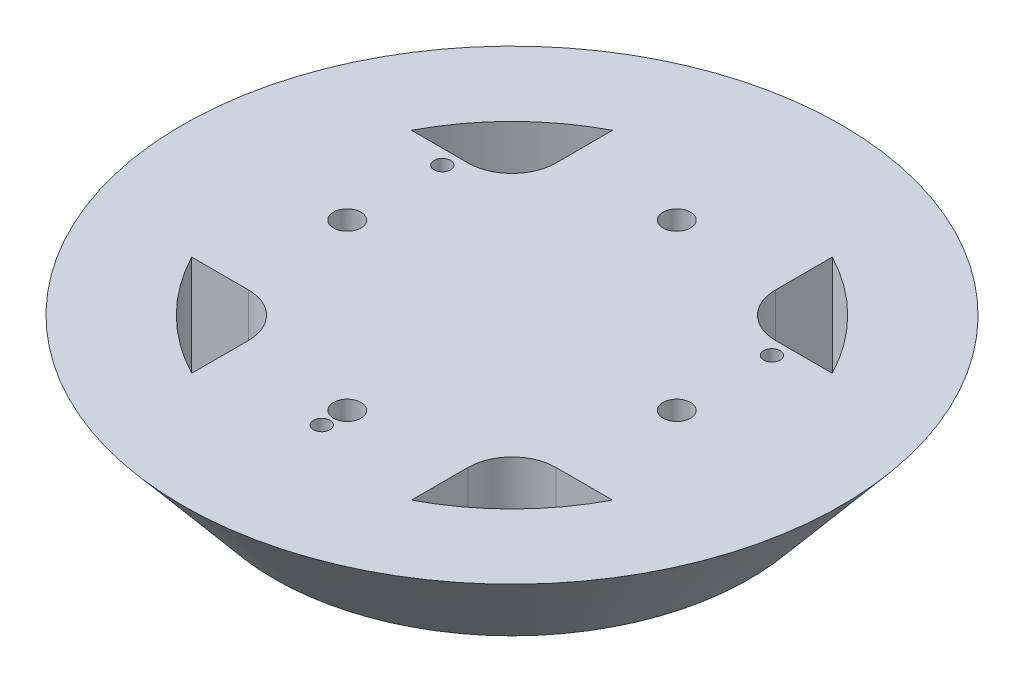
from build123d import *

# Parameters (mm, degrees)
SKETCH1_R             = 60
BOSS_EXTRUDE1_DEPTH   = 20
BOSS_EXTRUDE1_DRAFT   = -40
CUT_EXTRUDE1_DEPTH    = 25
F_3_0MM_DOWEL_HOLE1_D = 3
FILLET1_R             = 8
SKETCH13_R            = 2.5
CUT_EXTRUDE5_DEPTH    = 10


with BuildPart() as part:
    # Sketch1 → Boss-Extrude1 (with draft: the straight prism first)
    with BuildSketch(Plane(origin=(0, 0, 0), x_dir=(1, 0, 0), z_dir=(0, 1, 0))):
        Circle(SKETCH1_R)
    extrude(amount=-BOSS_EXTRUDE1_DEPTH)
    # Boss-Extrude1: the draft: its side faces are tilted about the plane it starts from
    boss_extrude1_sides = [part.faces().sort_by_distance(p)[0] for p in [
        (-60, -10, 0),
    ]]
    draft(boss_extrude1_sides, Plane(origin=(0, 0, 0), x_dir=(1, 0, 0), z_dir=(0, 1, 0)), BOSS_EXTRUDE1_DRAFT)

    # Sketch5 → Cut-Extrude1 (cut)
    with BuildSketch(Plane.XZ.offset(20)):
        with BuildLine():
            Line((-20, 20), (-20, 38.311827959))
            ThreePointArc((-20, 38.311827959), (-30.559746085, 30.559746085), (-38.311827959, 20))
            Line((-38.311827959, 20), (-20, 20))
        make_face()
        with BuildLine():
            ThreePointArc((38.311827959, 20), (30.559746085, 30.559746085), (20, 38.311827959))
            Line((20, 38.311827959), (20, 20))
            Line((20, 20), (38.311827959, 20))
        make_face()
        with BuildLine():
            Line((-20, -20), (-38.311827959, -20))
            ThreePointArc((-38.311827959, -20), (-30.559746085, -30.559746085), (-20, -38.311827959))
            Line((-20, -38.311827959), (-20, -20))
        make_face()
        with BuildLine():
            ThreePointArc((20, -38.311827959), (30.559746085, -30.559746085), (38.311827959, -20))
            Line((38.311827959, -20), (20, -20))
            Line((20, -20), (20, -38.311827959))
        make_face()
    extrude(amount=-CUT_EXTRUDE1_DEPTH, mode=Mode.SUBTRACT)

    # Ø3.0mm Dowel Hole1 (through all)
    with Locations(Plane(origin=(0, -20, 0), x_dir=(-1, 0, 0), z_dir=(0, -1, 0))):
        with Locations((0, -34.64), (-29.999119987, 17.32), (29.999119987, 17.32)):
            Hole(F_3_0MM_DOWEL_HOLE1_D / 2)

    # Fillet1
    fillet1_edges = [part.edges().sort_by_distance(p)[0] for p in [
        (-20, -10, -20),
        (20, -10, -20),
        (20, -10, 20),
        (-20, -10, 20),
    ]]
    fillet(fillet1_edges, radius=FILLET1_R)

    # Sketch13 → Cut-Extrude5 (cut)
    with BuildSketch(Plane(origin=(0, 0, 0), x_dir=(1, 0, 0), z_dir=(0, 1, 0))):
        with Locations(Location((0, 30, 0), (0, 0, 270))):
            Circle(SKETCH13_R)
        with Locations(Location((30, 0, 0), (0, 0, 270))):
            Circle(SKETCH13_R)
        with Locations(Location((0, -30, 0), (0, 0, 270))):
            Circle(SKETCH13_R)
        with Locations(Location((-30, 0, 0), (0, 0, 270))):
            Circle(SKETCH13_R)
    extrude(amount=-CUT_EXTRUDE5_DEPTH, mode=Mode.SUBTRACT)


solid = part.part
